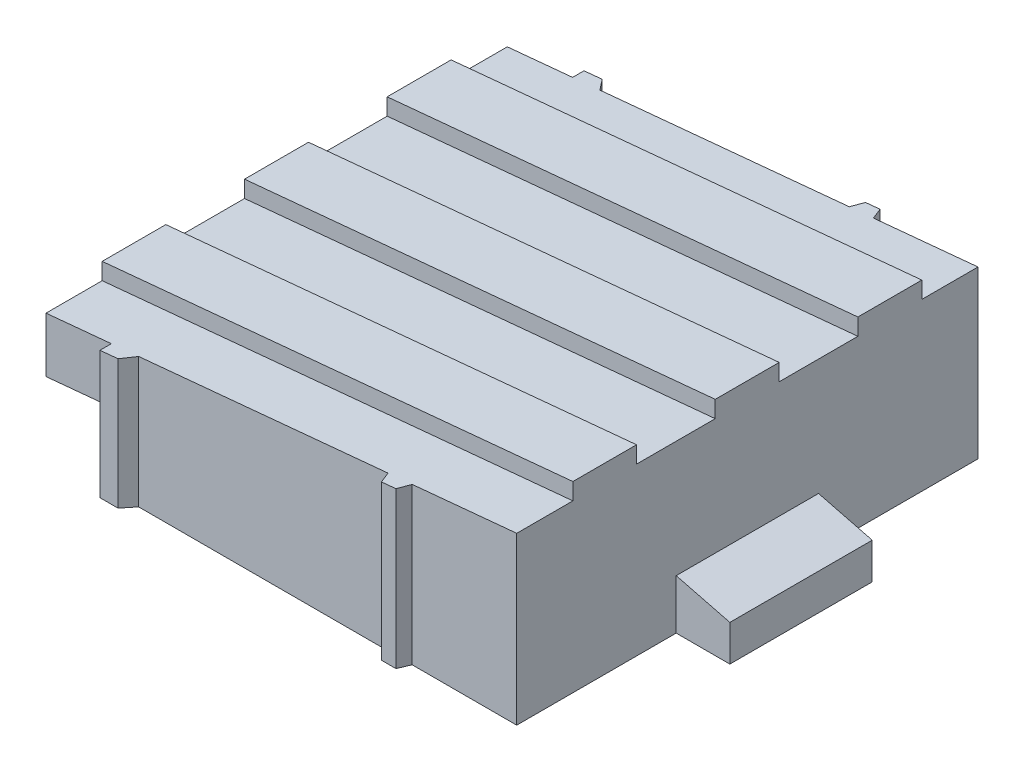
from build123d import *

# Parameters (mm, degrees)
BOSS_EXTRUDE1_DEPTH              = 16.59
BOSS_EXTRUDE2_DEPTH              = 6
SKETCH4_W                        = 17.571797515
SKETCH4_H                        = 4.04
SKETCH4_H_2                      = 2.83
CUT_EXTRUDE1_DEPTH               = 0.6
CUT_EXTRUDE2_DEPTH               = 1
SKETCH8_W                        = 5.12
SKETCH8_H                        = 1.79
BOSS_EXTRUDE3_DEPTH              = 1.93
CUT_EXTRUDE4_REACH               = 92.856
CUT_EXTRUDE5_REACH               = 95.246
CUT_EXTRUDE5_OFFSET_FROM_SURFACE = 1.93
SKETCH11_W                       = 4.3
SKETCH11_H                       = 6.9
BOSS_EXTRUDE4_DEPTH              = 1.22
BOSS_EXTRUDE5_DEPTH              = 4.3


with BuildPart() as part:
    # Sketch1 → Boss-Extrude1 (new body)
    with BuildSketch(Plane.XY):
        Polygon((-87.128079616, -11.030638703), (-72.548079616, -11.030638703), (-72.548079616, -4.450638703), (-85.740988622, -5.703457269), (-89.478079616, -6.058337075), (-89.478079616, -8.638337075), (-87.128079616, -8.415177525), align=None)
    extrude(amount=BOSS_EXTRUDE1_DEPTH)

    # Sketch6 → Boss-Extrude2 (add)
    with BuildSketch(Plane.XZ.offset(11.030638703)):
        Polygon((-87.128079616, 16.59), (-87.128079616, 17), (-86.474746282, 17), (-86.148079616, 16.59), align=None)
        Polygon((-77.178079616, 16.59), (-77.004079616, 17), (-76.482079616, 17), (-76.308079616, 16.59), align=None)
        Polygon((-87.128079616, 0), (-87.128079616, -0.41), (-86.474746282, -0.41), (-86.148079616, 0), align=None)
        Polygon((-77.178079616, 0), (-77.004079616, -0.41), (-76.482079616, -0.41), (-76.308079616, 0), align=None)
    extrude(amount=-BOSS_EXTRUDE2_DEPTH)

    # Sketch4 → Cut-Extrude1 (cut)
    with BuildSketch(Plane(origin=(-0.229506985, 2.416842188, 0), x_dir=(0.9955214229157637, 0.09453621801073521, 0), z_dir=(-0.0945362180107352, 0.9955214229157636, 0))):
        with Locations((-81.429812757, 0)):
            Rectangle(SKETCH4_W, SKETCH4_H)
        with Locations((-81.429812757, -16.59)):
            Rectangle(SKETCH4_W, SKETCH4_H)
        with Locations((-81.429812757, -5.735)):
            Rectangle(SKETCH4_W, SKETCH4_H_2)
        with Locations((-81.429812757, -10.865)):
            Rectangle(SKETCH4_W, SKETCH4_H_2)
    extrude(amount=-CUT_EXTRUDE1_DEPTH, mode=Mode.SUBTRACT)


with BuildPart() as cut_extrude1_piece_1:
    # of the separate pieces the step leaves, piece 1, a body of its own (cut_extrude1_pieces)
    add(part.part.solids().sort_by_distance((-87.128079616, -11.030638703, 17))[0])

    # Sketch8 → Boss-Extrude3 (add)
    with BuildSketch(Plane(origin=(-72.548079616, 0, 0), x_dir=(0, 0, -1), z_dir=(1, 0, 0))):
        with Locations((-8.295, -10.135638703)):
            Rectangle(SKETCH8_W, SKETCH8_H)
    extrude(amount=BOSS_EXTRUDE3_DEPTH)

    # Sketch9 → Cut-Extrude4 (cut, up to next)
    with BuildSketch(Plane.XY.offset(10.855), mode=Mode.PRIVATE) as cut_extrude4_sk1:
        Polygon((-70.618079616, -9.730638703), (-72.548079616, -9.240638703), (-70.618079616, -9.240638703), align=None)
    cut_extrude4_tool1 = extrude(cut_extrude4_sk1.sketch, amount=-CUT_EXTRUDE4_REACH, mode=Mode.PRIVATE) & cut_extrude1_piece_1.part
    add(cut_extrude4_tool1.solids().sort_by_distance((-71.261413, -9.403972, 10.855))[0], mode=Mode.SUBTRACT)

    # Cut-Extrude5: up to this face of the body (flat: up to its plane, moved by the offset)
    cut_extrude5_end = Plane(cut_extrude1_piece_1.part.faces().sort_by_distance((-81.032910057, -5.859070253, 15.601370182))[0]).offset(-CUT_EXTRUDE5_OFFSET_FROM_SURFACE)
    # Sketch10 → Cut-Extrude5 (cut, up to the picked face)
    with BuildSketch(Plane.XZ.offset(11.030638703), mode=Mode.PRIVATE) as cut_extrude5_sk1:
        Polygon((-74.058079616, 15.203261076), (-85.618079616, 15.203261076), (-85.618079616, 11.34), (-87.128079616, 11.34), (-87.128079616, 5.25), (-85.618079616, 5.25), (-85.618079616, 1.28), (-74.058079616, 1.28), align=None)
    cut_extrude5_tool1 = split(extrude(cut_extrude5_sk1.sketch, amount=-CUT_EXTRUDE5_REACH, mode=Mode.PRIVATE), bisect_by=cut_extrude5_end, keep=Keep.BOTH, mode=Mode.PRIVATE)
    add(cut_extrude5_tool1.solids().sort_by(Axis((-80.191272, -11.030639, 8.244515), (0, 1, 0)))[0], mode=Mode.SUBTRACT)


with BuildPart() as cut_extrude1_piece_2:
    # of the separate pieces the step leaves, piece 2, a body of its own (cut_extrude1_pieces)
    add(part.part.solids().sort_by_distance((-87.128079616, -5.835177525, 0))[0])


with BuildPart() as cut_extrude1_piece_3:
    # of the separate pieces the step leaves, piece 3, a body of its own (cut_extrude1_pieces)
    add(part.part.solids().sort_by_distance((-87.128079616, -5.835177525, 17))[0])


with BuildPart() as cut_extrude2_tool:
    # Sketch7 → Cut-Extrude2 (new body)
    with BuildSketch(Plane(origin=(0, -5.030638703, 0), x_dir=(1, 0, 0), z_dir=(0, 1, 0))):
        Polygon((-87.128079616, -17), (-86.474746282, -17), (-86.148079616, -16.59), (-87.128079616, -16.59), align=None)
        Polygon((-87.128079616, 0), (-87.128079616, 0.41), (-86.474746282, 0.41), (-86.148079616, 0), align=None)
    extrude(amount=-CUT_EXTRUDE2_DEPTH)


with BuildPart() as cut_extrude1_piece_2_1:
    add(cut_extrude1_piece_2.part)

    # Cut-Extrude2: cut by cut_extrude2_tool
    add(cut_extrude2_tool.part, mode=Mode.SUBTRACT)


with BuildPart() as cut_extrude1_piece_3_1:
    add(cut_extrude1_piece_3.part)

    # Cut-Extrude2: cut by cut_extrude2_tool
    add(cut_extrude2_tool.part, mode=Mode.SUBTRACT)


with BuildPart() as body_2:
    # Sketch11 → Boss-Extrude4 (new body)
    with BuildSketch(Plane.ZY.offset(89.478079616)):
        with Locations((8.295, -12.088337075)):
            Rectangle(SKETCH11_W, SKETCH11_H)
    extrude(amount=-BOSS_EXTRUDE4_DEPTH)

    # Sketch12 → Boss-Extrude5 (add)
    with BuildSketch(Plane(origin=(0, 0, 6.145), x_dir=(-1, 0, 0), z_dir=(0, 0, -1))):
        Polygon((89.478079616, -15.538337075), (89.808079616, -14.468337075), (89.478079616, -14.468337075), align=None)
    extrude(amount=-BOSS_EXTRUDE5_DEPTH)


solid = Compound([cut_extrude1_piece_1.part, body_2.part])
